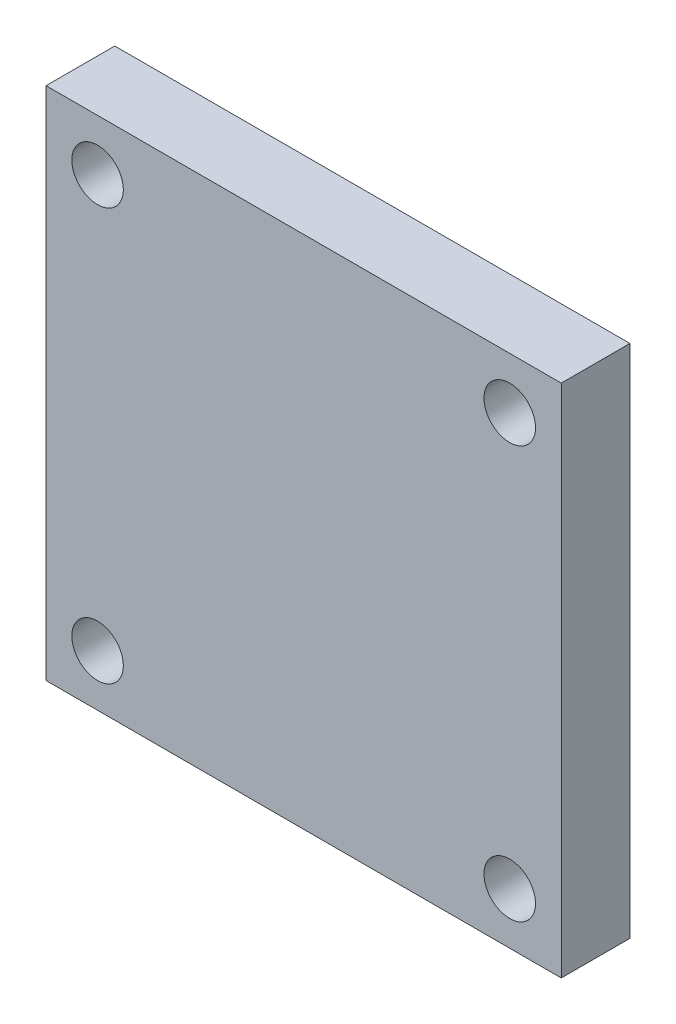
from build123d import *

# Parameters (mm, degrees)
ESQUISSE1_W        = 30
ESQUISSE1_H        = 30
ESQUISSE1_R        = 1.5
BOSS_EXTRU_1_DEPTH = 4


with BuildPart() as part:
    # Esquisse1 → Boss.-Extru.1 (new body)
    with BuildSketch(Plane.XY):
        with Locations((15, -15)):
            Rectangle(ESQUISSE1_W, ESQUISSE1_H)
        with Locations((3, -3)):
            Circle(ESQUISSE1_R, mode=Mode.SUBTRACT)
        with Locations((3, -27)):
            Circle(ESQUISSE1_R, mode=Mode.SUBTRACT)
        with Locations((27, -3)):
            Circle(ESQUISSE1_R, mode=Mode.SUBTRACT)
        with Locations((27, -27)):
            Circle(ESQUISSE1_R, mode=Mode.SUBTRACT)
    extrude(amount=BOSS_EXTRU_1_DEPTH)


solid = part.part
